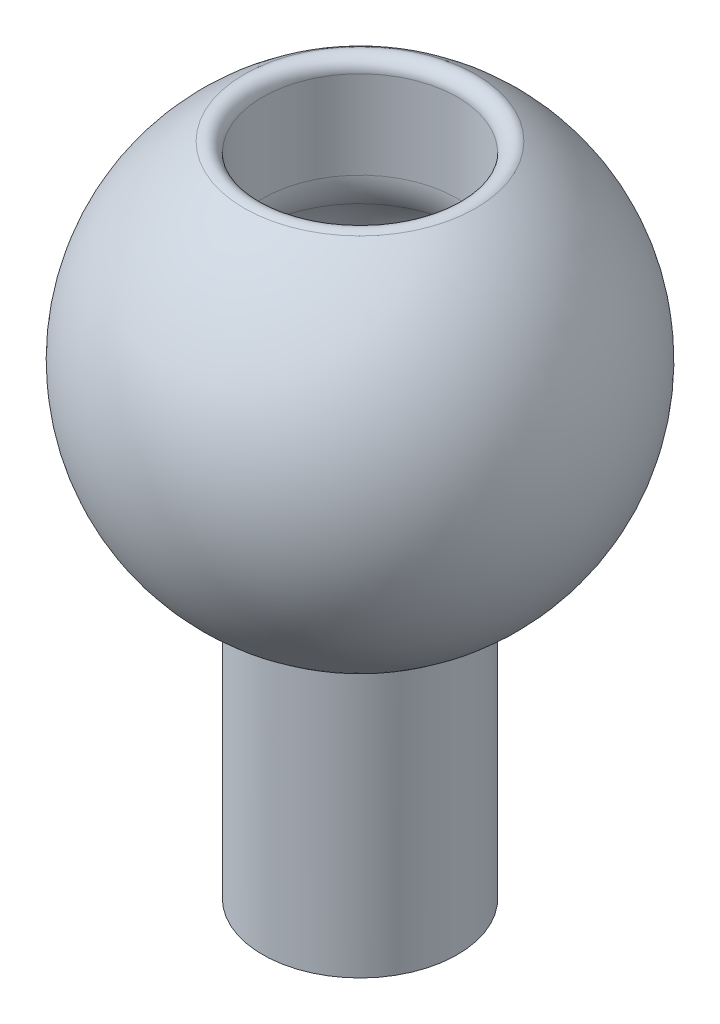
from build123d import *

# Parameters (mm, degrees)
SKETCH2_R                = 8
CUT_EXTRUDE1_DEPTH       = 16
FILLET2_R                = 5
FILLET3_R                = 1
BOSS_EXTRUDE1_DEPTH      = 20.085
BOSS_EXTRUDE1_DEPTH_BACK = 3
SKETCH3_R                = 8


with BuildPart() as part:
    # Sketch1 → Revolve1 (revolve)
    with BuildSketch(Plane(origin=(0, 0, 0), x_dir=(1, 0, 0), z_dir=(0, 1, 0))):
        with BuildLine():
            ThreePointArc((10, 0), (0, -10), (-10, 0))
            Line((-10, 0), (-18.232696005, 0))
            ThreePointArc((-18.232696005, 0), (0, -18.232696005), (18.232696005, 0))
            Line((18.232696005, 0), (10, 0))
        make_face()
    revolve(axis=Axis((-10, 0, 0), (1, 0, 0)))

    # Sketch2 → Cut-Extrude1 (cut)
    with BuildSketch(Plane(origin=(0, 18.232696005, 0), x_dir=(1, 0, 0), z_dir=(0, 1, 0))):
        with Locations(Location((0, 0, 0), (0, 0, 90))):
            Circle(SKETCH2_R)
    extrude(amount=-CUT_EXTRUDE1_DEPTH, mode=Mode.SUBTRACT)

    # Fillet2
    fillet2_edges = [part.edges().sort_by_distance(p)[0] for p in [
        (0, 6, 8),
    ]]
    fillet(fillet2_edges, radius=FILLET2_R)

    # Fillet3
    fillet3_edges = [part.edges().sort_by_distance(p)[0] for p in [
        (-1e-09, 16.383870227, 8),
    ]]
    fillet(fillet3_edges, radius=FILLET3_R)

    # Sketch3 → Boss-Extrude1 (add, two sides: drawn at the far end of the back side and taken through both)
    with BuildSketch(Plane(origin=(0, -18.232696005, 0), x_dir=(-1, 0, 0), z_dir=(0, -1, 0)).offset(-BOSS_EXTRUDE1_DEPTH_BACK)):
        with Locations(Location((0, 0, 0), (0, 0, 90))):
            Circle(SKETCH3_R)
    extrude(amount=BOSS_EXTRUDE1_DEPTH + BOSS_EXTRUDE1_DEPTH_BACK)


solid = part.part
